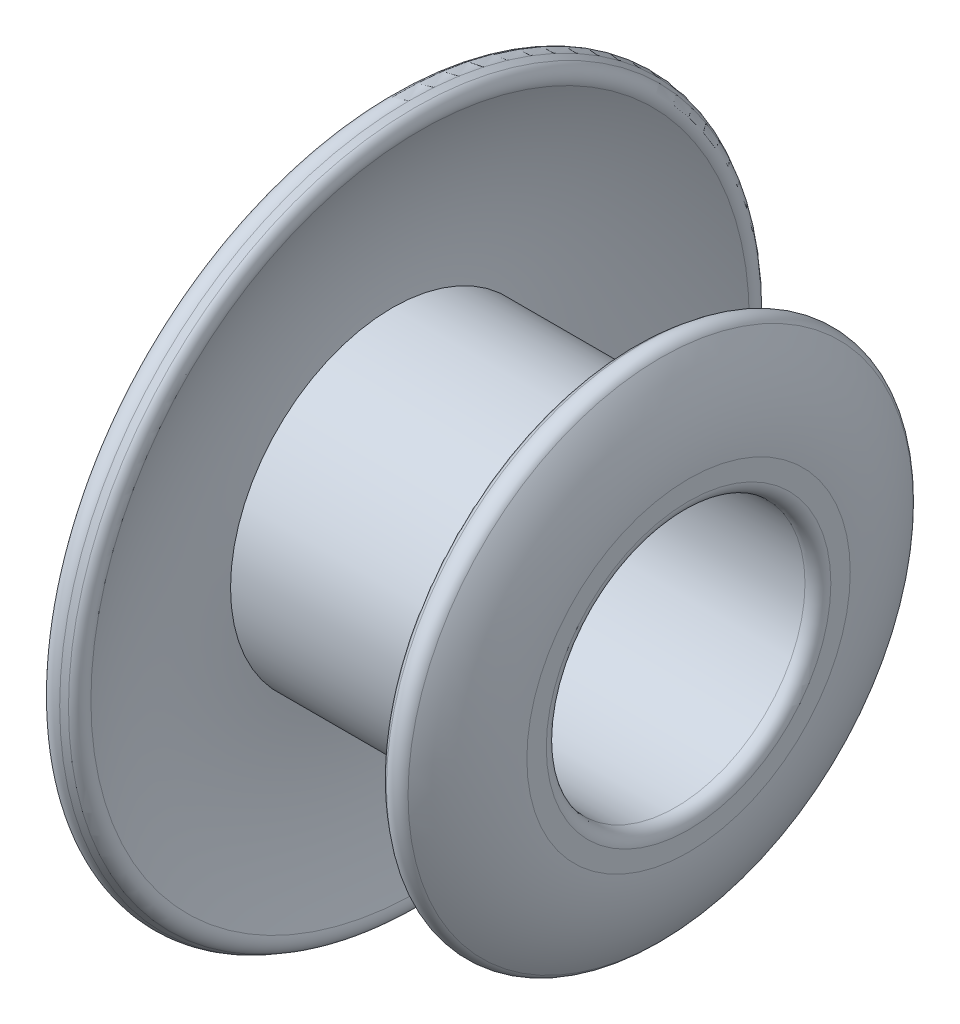
from build123d import *

# Parameters (mm, degrees)
FILLET1_R = 0.1


with BuildPart() as part:
    # Sketch1 → Revolve1 (revolve)
    with BuildSketch(Plane.XY):
        with BuildLine():
            ThreePointArc((-0.224797408, 1.881712705), (-0.057874055, 1.58525916), (0, 1.25))
            Line((0, 1.25), (-2, 1.25))
            Line((-2, 1.25), (-2.040639843, 1.25))
            ThreePointArc((-2.040639843, 1.25), (-2.021139042, 1.960479194), (-1.78099676, 2.629428109))
            Line((-1.78099676, 2.629428109), (-2, 2.75))
            ThreePointArc((-2, 2.75), (-2.284841337, 1.897834477), (-2.25, 1))
            Line((-2.25, 1), (0.25, 1))
            Line((0.25, 1), (0.25, 1.25))
            ThreePointArc((0.25, 1.25), (0.177657431, 1.66907395), (-0.03099676, 2.039640881))
            Line((-0.03099676, 2.039640881), (-0.224797408, 1.881712705))
        make_face()
    revolve(axis=Axis((0, 0, 0), (-1, 0, 0)))

    # Fillet1
    fillet1_edges = [part.edges().sort_by_distance(p)[0] for p in [
        (-2.25, -1, 0),
        (0.25, -1, 0),
        (-0.224797408, -1.881712705, 0),
        (-1.78099676, -2.629428109, 0),
        (-0.03099676, -2.039640881, 0),
        (-2, -2.75, 0),
    ]]
    fillet(fillet1_edges, radius=FILLET1_R)


solid = part.part
